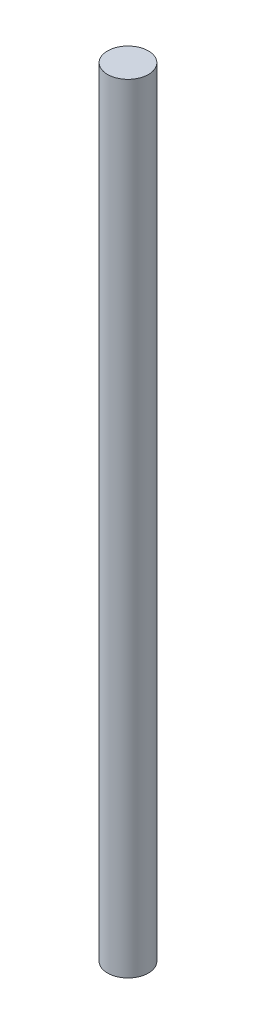
from build123d import *

# Parameters (mm, degrees)
SKETCH1_R           = 0.42
BOSS_EXTRUDE1_DEPTH = 16


with BuildPart() as part:
    # Sketch1 → Boss-Extrude1 (new body)
    with BuildSketch(Plane(origin=(0, 0, 0), x_dir=(1, 0, 0), z_dir=(0, 1, 0))):
        with Locations(Location((-78.298472197, 14.366692146, 0), (0, 0, 270))):
            Circle(SKETCH1_R)
    extrude(amount=BOSS_EXTRUDE1_DEPTH)


solid = part.part
